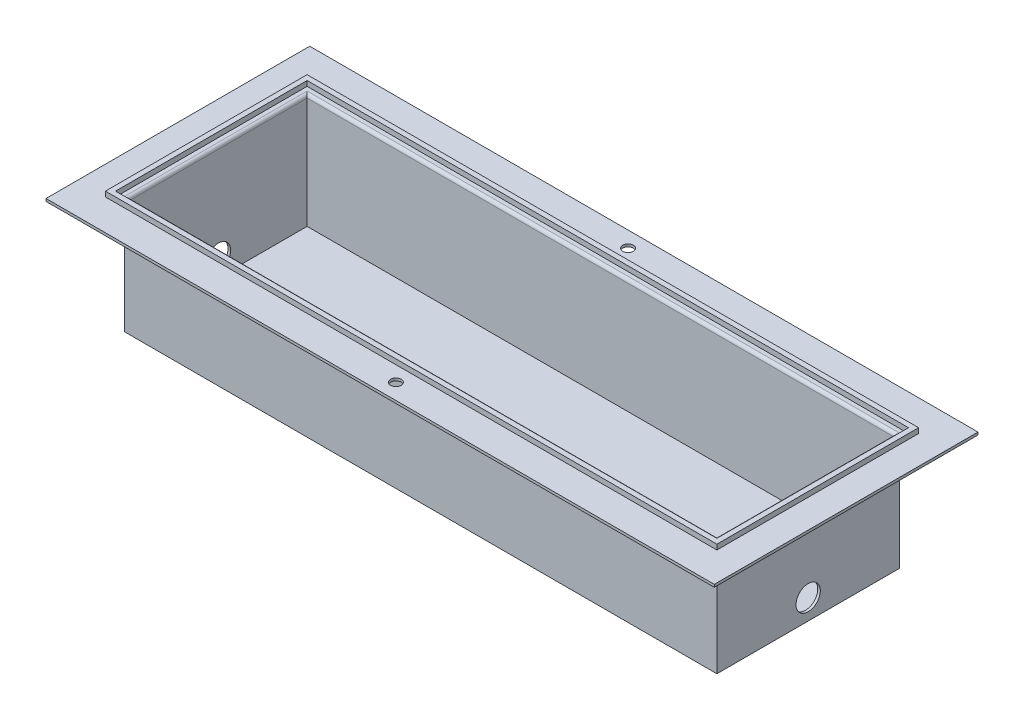
from build123d import *

# Parameters (mm, degrees)
SKETCH1_W           = 370.84
SKETCH1_H           = 114.3
BOSS_EXTRUDE1_DEPTH = 1.6256
SKETCH2_W           = 370.84
SKETCH2_H           = 114.3
SKETCH2_W_2         = 367.5888
SKETCH2_H_2         = 111.0488
BOSS_EXTRUDE2_DEPTH = 69.85
SKETCH3_W           = 418.3888
SKETCH3_H           = 165.1
SKETCH3_W_2         = 367.5888
SKETCH3_H_2         = 111.0488
BOSS_EXTRUDE3_DEPTH = 1.6256
FILLET1_R           = 1.905
SKETCH6_W           = 376.4788
SKETCH6_H           = 119.9388
BOSS_EXTRUDE4_DEPTH = 3.175
CUT_EXTRUDE1_REACH  = 238.475
SKETCH7_R           = 3.324987
SKETCH8_R           = 7.62
CUT_EXTRUDE2_DEPTH  = 411.308525227


with BuildPart() as part:
    # Sketch1 → Boss-Extrude1 (new body)
    with BuildSketch(Plane(origin=(0, 0, 0), x_dir=(1, 0, 0), z_dir=(0, 1, 0))):
        Rectangle(SKETCH1_W, SKETCH1_H)
    extrude(amount=BOSS_EXTRUDE1_DEPTH)

    # Sketch2 → Boss-Extrude2 (add)
    with BuildSketch(Plane(origin=(0, 1.6256, 0), x_dir=(1, 0, 0), z_dir=(0, 1, 0))):
        Rectangle(SKETCH2_W, SKETCH2_H)
        Rectangle(SKETCH2_W_2, SKETCH2_H_2, mode=Mode.SUBTRACT)
    extrude(amount=BOSS_EXTRUDE2_DEPTH)

    # Sketch3 → Boss-Extrude3 (add)
    with BuildSketch(Plane(origin=(0, 71.4756, 0), x_dir=(1, 0, 0), z_dir=(0, 1, 0))):
        Rectangle(SKETCH3_W, SKETCH3_H)
        Rectangle(SKETCH3_W_2, SKETCH3_H_2, mode=Mode.SUBTRACT)
    extrude(amount=BOSS_EXTRUDE3_DEPTH)

    # Fillet1
    fillet1_edges = [part.edges().sort_by_distance(p)[0] for p in [
        (0, 71.4756, -57.15),
        (-185.42, 71.4756, 0),
        (0, 71.4756, 57.15),
        (185.42, 71.4756, 0),
        (-183.7944, 73.1012, 0),
        (0, 73.1012, 55.5244),
        (183.7944, 73.1012, 0),
        (0, 73.1012, -55.5244),
    ]]
    fillet(fillet1_edges, radius=FILLET1_R)

    # Sketch6 → Boss-Extrude4 (add)
    with BuildSketch(Plane(origin=(0, 73.1012, 0), x_dir=(1, 0, 0), z_dir=(0, 1, 0))):
        Polygon((188.2394, -63.1444), (-188.2394, -63.1444), (-191.4144, -63.1444), (-191.4144, 63.1444), (-188.2394, 63.1444), (188.2394, 63.1444), (191.4144, 63.1444), (191.4144, -63.1444), align=None)
        Rectangle(SKETCH6_W, SKETCH6_H, mode=Mode.SUBTRACT)
    extrude(amount=BOSS_EXTRUDE4_DEPTH)

    # Sketch7 → Cut-Extrude1 (cut, up to next)
    with BuildSketch(Plane(origin=(0, 73.1012, 0), x_dir=(1, 0, 0), z_dir=(0, 1, 0)), mode=Mode.PRIVATE) as cut_extrude1_sk1:
        with Locations(Location((0, 72.676058371, 0), (0, 0, 270))):
            Circle(SKETCH7_R)
    cut_extrude1_tool1 = extrude(cut_extrude1_sk1.sketch, amount=-CUT_EXTRUDE1_REACH, mode=Mode.PRIVATE) & part.part
    # Sketch7 → Cut-Extrude1 (cut, up to next)
    with BuildSketch(Plane(origin=(0, 73.1012, 0), x_dir=(1, 0, 0), z_dir=(0, 1, 0)), mode=Mode.PRIVATE) as cut_extrude1_sk2:
        with Locations(Location((0, -72.676058371, 0), (0, 0, 90))):
            Circle(SKETCH7_R)
    cut_extrude1_tool2 = extrude(cut_extrude1_sk2.sketch, amount=-CUT_EXTRUDE1_REACH, mode=Mode.PRIVATE) & part.part
    add(cut_extrude1_tool1.solids().sort_by_distance((0, 73.1012, -72.676058))[0], mode=Mode.SUBTRACT)
    add(cut_extrude1_tool2.solids().sort_by_distance((0, 73.1012, 72.676058))[0], mode=Mode.SUBTRACT)

    # Sketch8 → Cut-Extrude2 (cut, through all)
    with BuildSketch(Plane(origin=(185.42, 0, 0), x_dir=(0, 0, -1), z_dir=(1, 0, 0))):
        with Locations((0, 12.7)):
            Circle(SKETCH8_R)
    extrude(amount=-CUT_EXTRUDE2_DEPTH, mode=Mode.SUBTRACT)


solid = part.part
